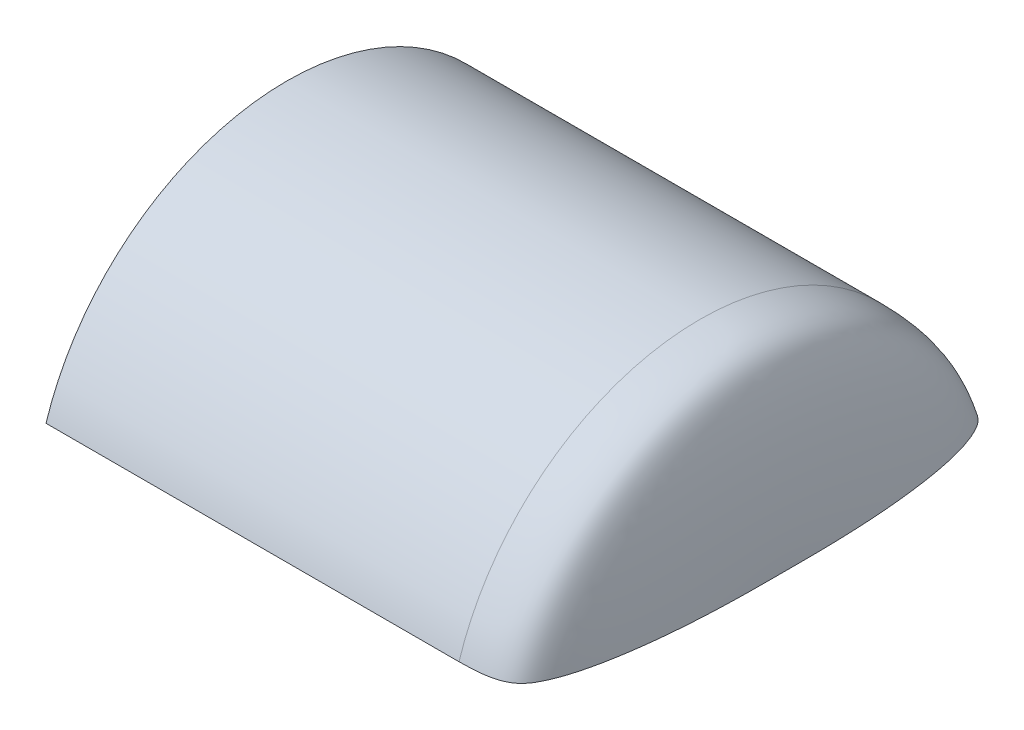
from build123d import *

# Parameters (mm, degrees)
ESBO_O3_OUTSIDE_W     = 90.748
ESBO_O3_OUTSIDE_H     = 90.748
CORTE_EXTRUS_O1_DEPTH = 88.281154989


with BuildPart() as part:
    # Esboço2 → Revolução1 (revolve)
    with BuildSketch(Plane.XY, mode=Mode.PRIVATE) as revolu_o1_sk:
        with BuildLine():
            Line((-27, 18), (-27, 15))
            Line((-27, 15), (27, 15))
            add(Edge.make_bspline(
                [(27, 15), (34.666666667, 15), (35, -2.184877438), (35, -5)],
                knots=[0, 0, 0, 0, 1, 1, 1, 1], degree=3))
            Line((35, -5), (38, -5))
            add(Edge.make_bspline(
                [(26.886465682, 18), (32.098350771, 18), (37.075539744, 14.364357804), (38, -2), (38, -5)],
                knots=[0, 0, 0, 0, 0.277641442, 1, 1, 1, 1], degree=3))
            Line((26.886465682, 18), (-27, 18))
        make_face()
    revolve(revolu_o1_sk.sketch.rotate(Axis((-27, -15, 0), (1, 0, 0)), 90), axis=Axis((-27, -15, 0), (1, 0, 0)))

    # Esboço3 outside → Corte-extrusão1 (cut, through all)
    with BuildSketch(Plane(origin=(38, 0, 0), x_dir=(0, 0, -1), z_dir=(1, 0, 0))):
        with Locations((0, -15)):
            Rectangle(ESBO_O3_OUTSIDE_W, ESBO_O3_OUTSIDE_H)
        with BuildLine():
            Line((-31.448313267, -5), (31.448313267, -5))
            ThreePointArc((31.448313267, -5), (0, 17.999945565), (-31.448313267, -5))
        make_face(mode=Mode.SUBTRACT)
    extrude(amount=-CORTE_EXTRUS_O1_DEPTH, mode=Mode.SUBTRACT)


solid = part.part
